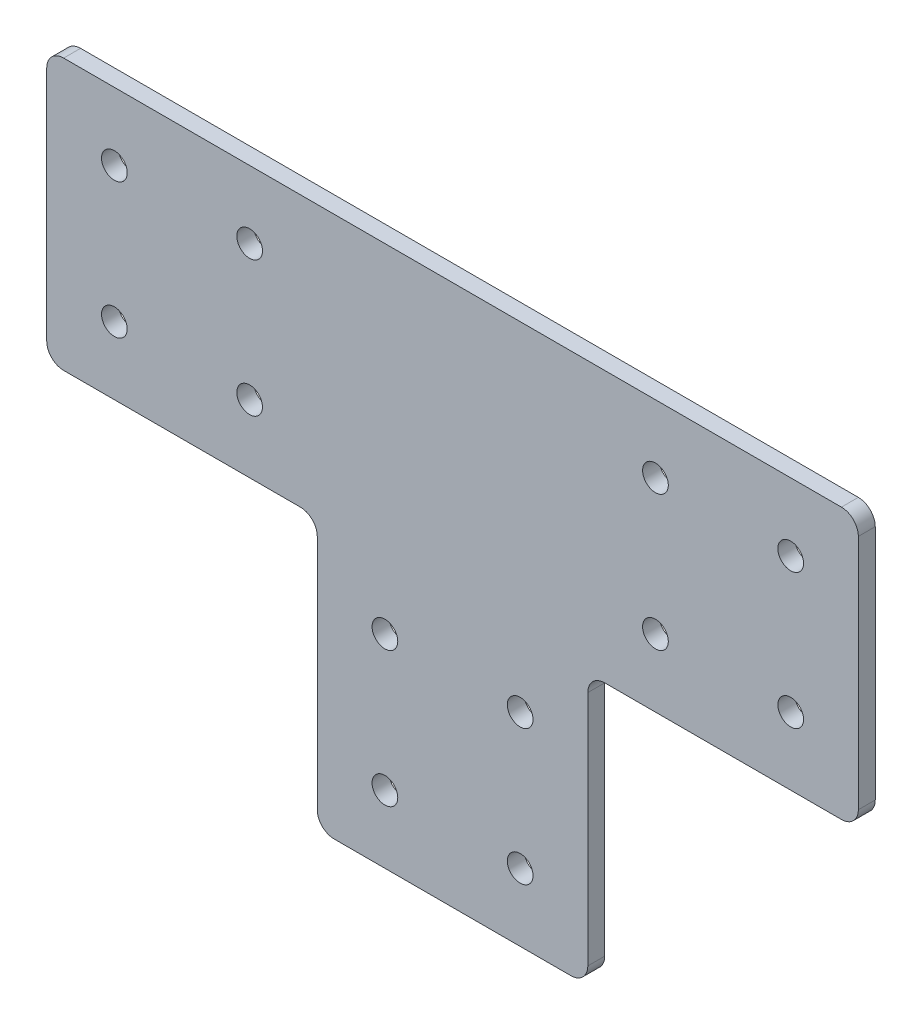
from build123d import *

# Parameters (mm, degrees)
SKETCH1_R           = 2.413
BOSS_EXTRUDE1_DEPTH = 3.175
FILLET1_R           = 3.175


with BuildPart() as part:
    # Sketch1 → Boss-Extrude1 (new body)
    with BuildSketch(Plane.XY):
        Polygon((-76.2, 0), (76.2, 0), (76.2, -50.8), (25.4, -50.8), (25.4, -101.6), (-25.4, -101.6), (-25.4, -50.8), (-76.2, -50.8), align=None)
        with Locations((-63.5, -12.7)):
            Circle(SKETCH1_R, mode=Mode.SUBTRACT)
        with Locations((-63.5, -38.1)):
            Circle(SKETCH1_R, mode=Mode.SUBTRACT)
        with Locations((-38.1, -12.7)):
            Circle(SKETCH1_R, mode=Mode.SUBTRACT)
        with Locations((-38.1, -38.1)):
            Circle(SKETCH1_R, mode=Mode.SUBTRACT)
        with Locations((-12.7, -88.9)):
            Circle(SKETCH1_R, mode=Mode.SUBTRACT)
        with Locations((-12.7, -63.5)):
            Circle(SKETCH1_R, mode=Mode.SUBTRACT)
        with Locations(Location((12.7, -88.9, 0), (0, 0, 180))):
            Circle(SKETCH1_R, mode=Mode.SUBTRACT)
        with Locations(Location((12.7, -63.5, 0), (0, 0, 180))):
            Circle(SKETCH1_R, mode=Mode.SUBTRACT)
        with Locations(Location((63.5, -38.1, 0), (0, 0, 180))):
            Circle(SKETCH1_R, mode=Mode.SUBTRACT)
        with Locations(Location((38.1, -38.1, 0), (0, 0, 180))):
            Circle(SKETCH1_R, mode=Mode.SUBTRACT)
        with Locations(Location((38.1, -12.7, 0), (0, 0, 180))):
            Circle(SKETCH1_R, mode=Mode.SUBTRACT)
        with Locations(Location((63.5, -12.7, 0), (0, 0, 180))):
            Circle(SKETCH1_R, mode=Mode.SUBTRACT)
    extrude(amount=BOSS_EXTRUDE1_DEPTH)

    # Fillet1
    fillet1_edges = [part.edges().sort_by_distance(p)[0] for p in [
        (25.4, -101.6, 1.5875),
        (-25.4, -101.6, 1.5875),
        (-25.4, -50.8, 1.5875),
        (-76.2, -50.8, 1.5875),
        (-76.2, 0, 1.5875),
        (76.2, 0, 1.5875),
        (76.2, -50.8, 1.5875),
        (25.4, -50.8, 1.5875),
    ]]
    fillet(fillet1_edges, radius=FILLET1_R)


solid = part.part
